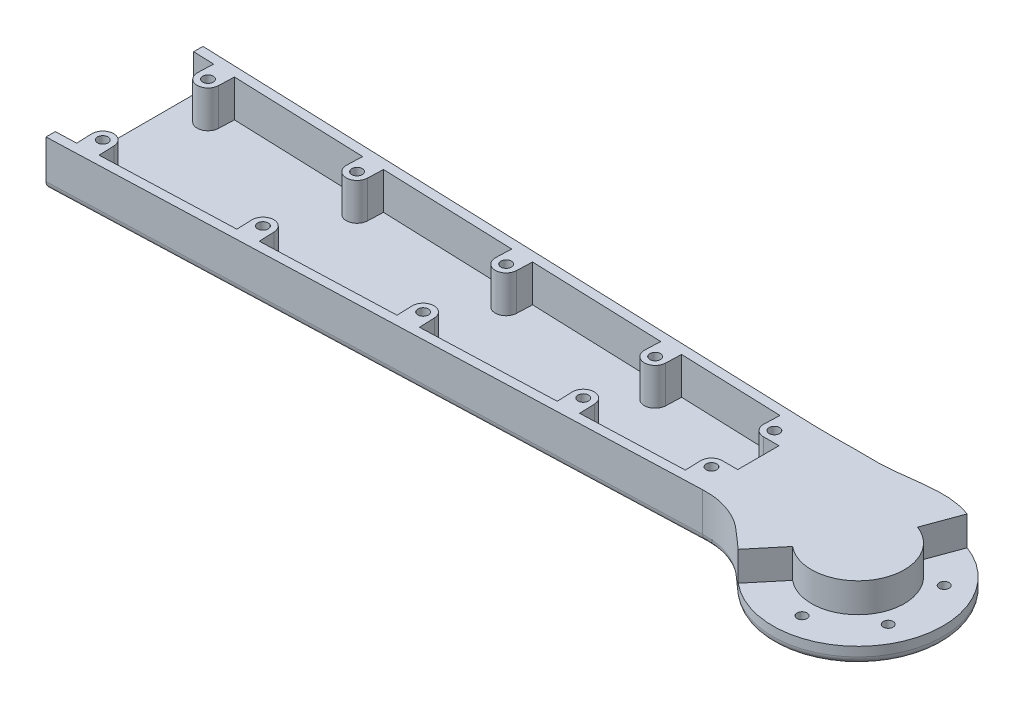
from build123d import *

# Parameters (mm, degrees)
SKETCH1_R           = 3
BOSS_EXTRUDE1_DEPTH = 15
BOSS_EXTRUDE2_DEPTH = 3
BOSS_EXTRUDE3_DEPTH = 15
SKETCH1_8_R         = 1.6
BOSS_EXTRUDE4_DEPTH = 5.5
BOSS_EXTRUDE5_START = 7.5
SKETCH1_9_R         = 3
SKETCH1_9_R_2       = 1.7
BOSS_EXTRUDE5_DEPTH = 7.5
FILLET1_R           = 2.5


with BuildPart() as part:
    # Sketch1 → Boss-Extrude1 (new body)
    # profile 1 of 12: a face of its own
    with BuildSketch(Plane(origin=(0, 0, 0), x_dir=(1, 0, 0), z_dir=(0, 1, 0))):
        Polygon((165, 18), (-40, 25.38), (-40, 22.378056629), (-33.317850729, 22.137499256), (-26.322382325, 21.885662393), (16.682149271, 20.337499256), (23.677617675, 20.085662393), (66.682149271, 18.537499256), (73.677617675, 18.285662393), (116.682149271, 16.737499256), (123.677617675, 16.485662393), (156.682149271, 15.297499256), (165, 14.998056629), align=None)
    # profile 2 of 12: a face of its own
    with BuildSketch(Plane(origin=(0, 0, 0), x_dir=(1, 0, 0), z_dir=(0, 1, 0))):
        Polygon((-33.317850729, -22.137499256), (-40, -22.378056629), (-40, -25.38), (165, -18), (165, -14.998056629), (156.682149271, -15.297499256), (123.677617675, -16.485662393), (116.682149271, -16.737499256), (73.677617675, -18.285662393), (66.682149271, -18.537499256), (23.677617675, -20.085662393), (16.682149271, -20.337499256), (-26.322382325, -21.885662393), align=None)
    # profile 3 of 12: a face of its own
    with BuildSketch(Plane(origin=(0, 0, 0), x_dir=(1, 0, 0), z_dir=(0, 1, 0))):
        with BuildLine():
            Line((-26.322382325, 21.885662393), (-33.317850729, 22.137499256))
            Line((-33.317850729, 22.137499256), (-33.497734202, 17.14073611))
            ThreePointArc((-33.497734202, 17.14073611), (-30.125918431, 13.517083476), (-26.502265798, 16.888899247))
            Line((-26.502265798, 16.888899247), (-26.322382325, 21.885662393))
        make_face()
        with Locations(Location((-30, 17.014817679, 0), (0, 0, 270))):
            Circle(SKETCH1_R, mode=Mode.SUBTRACT)
    # profile 4 of 12: a face of its own
    with BuildSketch(Plane(origin=(0, 0, 0), x_dir=(1, 0, 0), z_dir=(0, 1, 0))):
        with BuildLine():
            Line((-33.497734202, -17.14073611), (-33.317850729, -22.137499256))
            Line((-33.317850729, -22.137499256), (-26.322382325, -21.885662393))
            Line((-26.322382325, -21.885662393), (-26.502265798, -16.888899247))
            ThreePointArc((-26.502265798, -16.888899247), (-30.125918431, -13.517083476), (-33.497734202, -17.14073611))
        make_face()
        with Locations(Location((-30, -17.014817679, 0), (0, 0, 270))):
            Circle(SKETCH1_R, mode=Mode.SUBTRACT)
    # profile 5 of 12: a face of its own
    with BuildSketch(Plane(origin=(0, 0, 0), x_dir=(1, 0, 0), z_dir=(0, 1, 0))):
        with BuildLine():
            Line((16.502265798, -15.34073611), (16.682149271, -20.337499256))
            Line((16.682149271, -20.337499256), (23.677617675, -20.085662393))
            Line((23.677617675, -20.085662393), (23.497734202, -15.088899247))
            ThreePointArc((23.497734202, -15.088899247), (19.874081569, -11.717083476), (16.502265798, -15.34073611))
        make_face()
        with Locations(Location((20, -15.214817679, 0), (0, 0, 270))):
            Circle(SKETCH1_R, mode=Mode.SUBTRACT)
    # profile 6 of 12: a face of its own
    with BuildSketch(Plane(origin=(0, 0, 0), x_dir=(1, 0, 0), z_dir=(0, 1, 0))):
        with BuildLine():
            Line((23.677617675, 20.085662393), (16.682149271, 20.337499256))
            Line((16.682149271, 20.337499256), (16.502265798, 15.34073611))
            ThreePointArc((16.502265798, 15.34073611), (19.874081569, 11.717083476), (23.497734202, 15.088899247))
            Line((23.497734202, 15.088899247), (23.677617675, 20.085662393))
        make_face()
        with Locations(Location((20, 15.214817679, 0), (0, 0, 270))):
            Circle(SKETCH1_R, mode=Mode.SUBTRACT)
    # profile 7 of 12: a face of its own
    with BuildSketch(Plane(origin=(0, 0, 0), x_dir=(1, 0, 0), z_dir=(0, 1, 0))):
        with BuildLine():
            Line((73.497734202, 13.288899247), (73.677617675, 18.285662393))
            Line((73.677617675, 18.285662393), (66.682149271, 18.537499256))
            Line((66.682149271, 18.537499256), (66.502265798, 13.54073611))
            ThreePointArc((66.502265798, 13.54073611), (69.874081569, 9.917083476), (73.497734202, 13.288899247))
        make_face()
        with Locations(Location((70, 13.414817679, 0), (0, 0, 270))):
            Circle(SKETCH1_R, mode=Mode.SUBTRACT)
    # profile 8 of 12: a face of its own
    with BuildSketch(Plane(origin=(0, 0, 0), x_dir=(1, 0, 0), z_dir=(0, 1, 0))):
        with BuildLine():
            Line((66.502265798, -13.54073611), (66.682149271, -18.537499256))
            Line((66.682149271, -18.537499256), (73.677617675, -18.285662393))
            Line((73.677617675, -18.285662393), (73.497734202, -13.288899247))
            ThreePointArc((73.497734202, -13.288899247), (69.874081569, -9.917083476), (66.502265798, -13.54073611))
        make_face()
        with Locations(Location((70, -13.414817679, 0), (0, 0, 270))):
            Circle(SKETCH1_R, mode=Mode.SUBTRACT)
    # profile 9 of 12: a face of its own
    with BuildSketch(Plane(origin=(0, 0, 0), x_dir=(1, 0, 0), z_dir=(0, 1, 0))):
        with BuildLine():
            Line((165, -14.998056629), (165, -6.674817679))
            Line((165, -6.674817679), (160, -6.674817679))
            ThreePointArc((160, -6.674817679), (157.481000743, -7.744870612), (156.502265798, -10.30073611))
            Line((156.502265798, -10.30073611), (156.682149271, -15.297499256))
            Line((156.682149271, -15.297499256), (165, -14.998056629))
        make_face()
        with Locations(Location((160, -10.174817679, 0), (0, 0, 270))):
            Circle(SKETCH1_R, mode=Mode.SUBTRACT)
    # profile 10 of 12: a face of its own
    with BuildSketch(Plane(origin=(0, 0, 0), x_dir=(1, 0, 0), z_dir=(0, 1, 0))):
        with BuildLine():
            Line((165, 6.674817679), (165, 14.998056629))
            Line((165, 14.998056629), (156.682149271, 15.297499256))
            Line((156.682149271, 15.297499256), (156.502265798, 10.30073611))
            ThreePointArc((156.502265798, 10.30073611), (157.481000743, 7.744870612), (160, 6.674817679))
            Line((160, 6.674817679), (165, 6.674817679))
        make_face()
        with Locations(Location((160, 10.174817679, 0), (0, 0, 270))):
            Circle(SKETCH1_R, mode=Mode.SUBTRACT)
    # profile 11 of 12: a face of its own
    with BuildSketch(Plane(origin=(0, 0, 0), x_dir=(1, 0, 0), z_dir=(0, 1, 0))):
        with BuildLine():
            Line((123.497734202, 11.488899247), (123.677617675, 16.485662393))
            Line((123.677617675, 16.485662393), (116.682149271, 16.737499256))
            Line((116.682149271, 16.737499256), (116.502265798, 11.74073611))
            ThreePointArc((116.502265798, 11.74073611), (119.874081569, 8.117083476), (123.497734202, 11.488899247))
        make_face()
        with Locations(Location((120, 11.614817679, 0), (0, 0, 270))):
            Circle(SKETCH1_R, mode=Mode.SUBTRACT)
    # profile 12 of 12: a face of its own
    with BuildSketch(Plane(origin=(0, 0, 0), x_dir=(1, 0, 0), z_dir=(0, 1, 0))):
        with BuildLine():
            Line((116.682149271, -16.737499256), (123.677617675, -16.485662393))
            Line((123.677617675, -16.485662393), (123.497734202, -11.488899247))
            ThreePointArc((123.497734202, -11.488899247), (119.874081569, -8.117083476), (116.502265798, -11.74073611))
            Line((116.502265798, -11.74073611), (116.682149271, -16.737499256))
        make_face()
        with Locations(Location((120, -11.614817679, 0), (0, 0, 270))):
            Circle(SKETCH1_R, mode=Mode.SUBTRACT)
    extrude(amount=BOSS_EXTRUDE1_DEPTH)

    # Sketch1<3> → Boss-Extrude2 (add)
    with BuildSketch(Plane(origin=(0, 0, 0), x_dir=(1, 0, 0), z_dir=(0, 1, 0))):
        with BuildLine():
            Line((-33.317850729, 22.137499256), (-40, 22.378056629))
            Line((-40, 22.378056629), (-40, -22.378056629))
            Line((-40, -22.378056629), (-33.317850729, -22.137499256))
            Line((-33.317850729, -22.137499256), (-33.497734202, -17.14073611))
            ThreePointArc((-33.497734202, -17.14073611), (-30.125918431, -13.517083476), (-26.502265798, -16.888899247))
            Line((-26.502265798, -16.888899247), (-26.322382325, -21.885662393))
            Line((-26.322382325, -21.885662393), (16.682149271, -20.337499256))
            Line((16.682149271, -20.337499256), (16.502265798, -15.34073611))
            ThreePointArc((16.502265798, -15.34073611), (19.874081569, -11.717083476), (23.497734202, -15.088899247))
            Line((23.497734202, -15.088899247), (23.677617675, -20.085662393))
            Line((23.677617675, -20.085662393), (66.682149271, -18.537499256))
            Line((66.682149271, -18.537499256), (66.502265798, -13.54073611))
            ThreePointArc((66.502265798, -13.54073611), (69.874081569, -9.917083476), (73.497734202, -13.288899247))
            Line((73.497734202, -13.288899247), (73.677617675, -18.285662393))
            Line((73.677617675, -18.285662393), (116.682149271, -16.737499256))
            Line((116.682149271, -16.737499256), (116.502265798, -11.74073611))
            ThreePointArc((116.502265798, -11.74073611), (119.874081569, -8.117083476), (123.497734202, -11.488899247))
            Line((123.497734202, -11.488899247), (123.677617675, -16.485662393))
            Line((123.677617675, -16.485662393), (156.682149271, -15.297499256))
            Line((156.682149271, -15.297499256), (156.502265798, -10.30073611))
            ThreePointArc((156.502265798, -10.30073611), (157.481000743, -7.744870612), (160, -6.674817679))
            Line((160, -6.674817679), (165, -6.674817679))
            Line((165, -6.674817679), (165, 6.674817679))
            Line((165, 6.674817679), (160, 6.674817679))
            ThreePointArc((160, 6.674817679), (157.481000743, 7.744870612), (156.502265798, 10.30073611))
            Line((156.502265798, 10.30073611), (156.682149271, 15.297499256))
            Line((156.682149271, 15.297499256), (123.677617675, 16.485662393))
            Line((123.677617675, 16.485662393), (123.497734202, 11.488899247))
            ThreePointArc((123.497734202, 11.488899247), (119.874081569, 8.117083476), (116.502265798, 11.74073611))
            Line((116.502265798, 11.74073611), (116.682149271, 16.737499256))
            Line((116.682149271, 16.737499256), (73.677617675, 18.285662393))
            Line((73.677617675, 18.285662393), (73.497734202, 13.288899247))
            ThreePointArc((73.497734202, 13.288899247), (69.874081569, 9.917083476), (66.502265798, 13.54073611))
            Line((66.502265798, 13.54073611), (66.682149271, 18.537499256))
            Line((66.682149271, 18.537499256), (23.677617675, 20.085662393))
            Line((23.677617675, 20.085662393), (23.497734202, 15.088899247))
            ThreePointArc((23.497734202, 15.088899247), (19.874081569, 11.717083476), (16.502265798, 15.34073611))
            Line((16.502265798, 15.34073611), (16.682149271, 20.337499256))
            Line((16.682149271, 20.337499256), (-26.322382325, 21.885662393))
            Line((-26.322382325, 21.885662393), (-26.502265798, 16.888899247))
            ThreePointArc((-26.502265798, 16.888899247), (-30.125918431, 13.517083476), (-33.497734202, 17.14073611))
            Line((-33.497734202, 17.14073611), (-33.317850729, 22.137499256))
        make_face()
    extrude(amount=BOSS_EXTRUDE2_DEPTH)

    # Sketch1<6> → Boss-Extrude3 (add)
    with BuildSketch(Plane(origin=(0, 0, 0), x_dir=(1, 0, 0), z_dir=(0, 1, 0))):
        with BuildLine():
            add(Edge.make_bspline(
                [(165, 18), (170.687351887, 17.795255332), (176.060764501, 18.188926085), (189.12847286, 17.602180288), (197.016631904, 19.157655505), (201.641845094, 19.49392804)],
                knots=[0, 0, 0, 0, 0.252432342, 0.452762648, 0.738260646, 0.738260646, 0.738260646, 0.738260646], degree=3))
            Line((165, 18), (165, 14.998056629))
            Line((165, 14.998056629), (165, 6.674817679))
            Line((165, 6.674817679), (165, -6.674817679))
            Line((165, -6.674817679), (165, -14.998056629))
            Line((165, -14.998056629), (165, -18))
            add(Edge.make_bspline(
                [(165, -18), (166.601511174, -17.942345598), (171.451143214, -18.164575777), (180.020858869, -21.618148322), (183.726782263, -25.875598305), (187.415427446, -28.94341212)],
                knots=[0, 0, 0, 0, 0.193014913, 0.557683451, 1, 1, 1, 1], degree=3))
            ThreePointArc((187.415427446, -28.94341212), (178.614522199, -0.050644896), (201.641845094, 19.49392804))
        make_face()
        with BuildLine():
            add(Edge.make_bspline(
                [(201.641845094, 19.49392804), (205.882156144, 19.802216564), (210.113827287, 19.624865914), (214.51821907, 18)],
                knots=[0.738260646, 0.738260646, 0.738260646, 0.738260646, 1, 1, 1, 1], degree=3))
            ThreePointArc((201.641845094, 19.49392804), (178.614522199, -0.050644896), (187.415427446, -28.94341212))
            Line((187.415427446, -28.94341212), (195.40841497, -19.332889219))
            Line((195.40841497, -19.332889219), (205, -7.800261738))
            Line((205, -7.800261738), (210.191755856, 6.272608301))
            Line((210.191755856, 6.272608301), (214.51821907, 18))
        make_face()
        with BuildLine():
            ThreePointArc((195.40841497, -19.332889219), (217.990381057, -15.300261738), (210.191755856, 6.272608301))
            Line((210.191755856, 6.272608301), (205, -7.800261738))
            Line((205, -7.800261738), (195.40841497, -19.332889219))
        make_face()
    extrude(amount=BOSS_EXTRUDE3_DEPTH)

    # Sketch1<8> → Boss-Extrude4 (add)
    with BuildSketch(Plane(origin=(0, 0, 0), x_dir=(1, 0, 0), z_dir=(0, 1, 0))):
        with BuildLine():
            ThreePointArc((232.5, -7.800261738), (227.561039697, 7.923907168), (214.51821907, 18))
            Line((214.51821907, 18), (210.191755856, 6.272608301))
            ThreePointArc((210.191755856, 6.272608301), (217.990381057, -15.300261738), (195.40841497, -19.332889219))
            Line((195.40841497, -19.332889219), (187.415427446, -28.94341212))
            ThreePointArc((187.415427446, -28.94341212), (216.67634906, -32.698311313), (232.5, -7.800261738))
        make_face()
        with Locations(Location((206.830032373, -27.716360289, 0), (0, 0, 270))):
            Circle(SKETCH1_8_R, mode=Mode.SUBTRACT)
        with Locations(Location((223.162863476, -16.173456489, 0), (0, 0, 270))):
            Circle(SKETCH1_8_R, mode=Mode.SUBTRACT)
        with Locations(Location((221.332831103, 3.742642063, 0), (0, 0, 270))):
            Circle(SKETCH1_8_R, mode=Mode.SUBTRACT)
    extrude(amount=BOSS_EXTRUDE4_DEPTH)

    # Sketch1<9> → Boss-Extrude5 (add)
    # profile 1 of 10: a face of its own
    with BuildSketch(Plane(origin=(0, 0, 0), x_dir=(1, 0, 0), z_dir=(0, 1, 0)).offset(BOSS_EXTRUDE5_START)):
        with Locations(Location((160, 10.174817679, 0), (0, 0, 270))):
            Circle(SKETCH1_9_R)
        with Locations(Location((160, 10.174817679, 0), (0, 0, 270))):
            Circle(SKETCH1_9_R_2, mode=Mode.SUBTRACT)
    # profile 2 of 10: a face of its own
    with BuildSketch(Plane(origin=(0, 0, 0), x_dir=(1, 0, 0), z_dir=(0, 1, 0)).offset(BOSS_EXTRUDE5_START)):
        with Locations(Location((160, -10.174817679, 0), (0, 0, 270))):
            Circle(SKETCH1_9_R)
        with Locations(Location((160, -10.174817679, 0), (0, 0, 270))):
            Circle(SKETCH1_9_R_2, mode=Mode.SUBTRACT)
    # profile 3 of 10: a face of its own
    with BuildSketch(Plane(origin=(0, 0, 0), x_dir=(1, 0, 0), z_dir=(0, 1, 0)).offset(BOSS_EXTRUDE5_START)):
        with Locations(Location((70, 13.414817679, 0), (0, 0, 270))):
            Circle(SKETCH1_9_R)
        with Locations(Location((70, 13.414817679, 0), (0, 0, 270))):
            Circle(SKETCH1_9_R_2, mode=Mode.SUBTRACT)
    # profile 4 of 10: a face of its own
    with BuildSketch(Plane(origin=(0, 0, 0), x_dir=(1, 0, 0), z_dir=(0, 1, 0)).offset(BOSS_EXTRUDE5_START)):
        with Locations(Location((70, -13.414817679, 0), (0, 0, 270))):
            Circle(SKETCH1_9_R)
        with Locations(Location((70, -13.414817679, 0), (0, 0, 270))):
            Circle(SKETCH1_9_R_2, mode=Mode.SUBTRACT)
    # profile 5 of 10: a face of its own
    with BuildSketch(Plane(origin=(0, 0, 0), x_dir=(1, 0, 0), z_dir=(0, 1, 0)).offset(BOSS_EXTRUDE5_START)):
        with Locations(Location((20, 15.214817679, 0), (0, 0, 270))):
            Circle(SKETCH1_9_R)
        with Locations(Location((20, 15.214817679, 0), (0, 0, 270))):
            Circle(SKETCH1_9_R_2, mode=Mode.SUBTRACT)
    # profile 6 of 10: a face of its own
    with BuildSketch(Plane(origin=(0, 0, 0), x_dir=(1, 0, 0), z_dir=(0, 1, 0)).offset(BOSS_EXTRUDE5_START)):
        with Locations(Location((20, -15.214817679, 0), (0, 0, 270))):
            Circle(SKETCH1_9_R)
        with Locations(Location((20, -15.214817679, 0), (0, 0, 270))):
            Circle(SKETCH1_9_R_2, mode=Mode.SUBTRACT)
    # profile 7 of 10: a face of its own
    with BuildSketch(Plane(origin=(0, 0, 0), x_dir=(1, 0, 0), z_dir=(0, 1, 0)).offset(BOSS_EXTRUDE5_START)):
        with Locations(Location((-30, -17.014817679, 0), (0, 0, 270))):
            Circle(SKETCH1_9_R)
        with Locations(Location((-30, -17.014817679, 0), (0, 0, 270))):
            Circle(SKETCH1_9_R_2, mode=Mode.SUBTRACT)
    # profile 8 of 10: a face of its own
    with BuildSketch(Plane(origin=(0, 0, 0), x_dir=(1, 0, 0), z_dir=(0, 1, 0)).offset(BOSS_EXTRUDE5_START)):
        with Locations(Location((-30, 17.014817679, 0), (0, 0, 270))):
            Circle(SKETCH1_9_R)
        with Locations(Location((-30, 17.014817679, 0), (0, 0, 270))):
            Circle(SKETCH1_9_R_2, mode=Mode.SUBTRACT)
    # profile 9 of 10: a face of its own
    with BuildSketch(Plane(origin=(0, 0, 0), x_dir=(1, 0, 0), z_dir=(0, 1, 0)).offset(BOSS_EXTRUDE5_START)):
        with Locations(Location((120, 11.614817679, 0), (0, 0, 270))):
            Circle(SKETCH1_9_R)
        with Locations(Location((120, 11.614817679, 0), (0, 0, 270))):
            Circle(SKETCH1_9_R_2, mode=Mode.SUBTRACT)
    # profile 10 of 10: a face of its own
    with BuildSketch(Plane(origin=(0, 0, 0), x_dir=(1, 0, 0), z_dir=(0, 1, 0)).offset(BOSS_EXTRUDE5_START)):
        with Locations(Location((120, -11.614817679, 0), (0, 0, 270))):
            Circle(SKETCH1_9_R)
        with Locations(Location((120, -11.614817679, 0), (0, 0, 270))):
            Circle(SKETCH1_9_R_2, mode=Mode.SUBTRACT)
    extrude(amount=BOSS_EXTRUDE5_DEPTH)

    # Fillet1
    fillet1_edges = [part.edges().sort_by_distance(p)[0] for p in [
        (62.5, 0, 21.69),
        (177.397012756, 0, 20.888527902),
        (183.361330797, 0, -17.922851787),
        (228.815698604, 0, 21.550261738),
        (62.5, 0, -21.69),
    ]]
    fillet(fillet1_edges, radius=FILLET1_R)


solid = part.part
